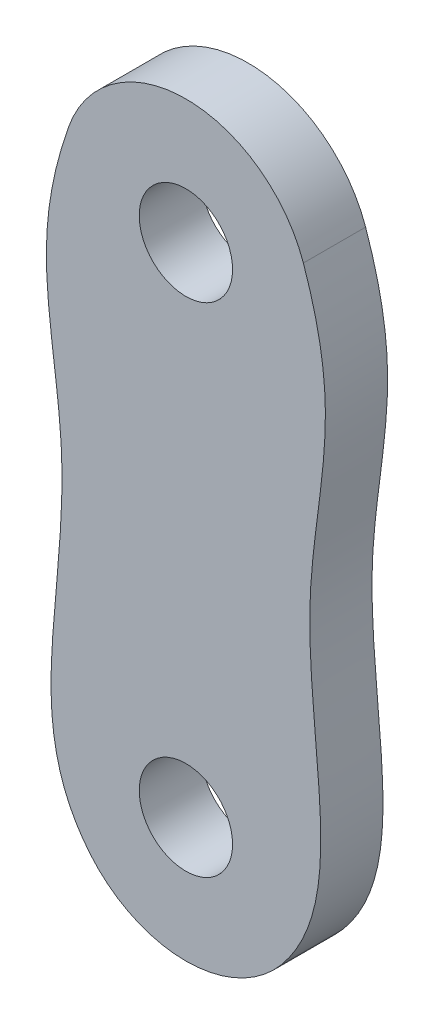
from build123d import *

# Parameters (mm, degrees)
SKETCH1_R           = 2.38125
BOSS_EXTRUDE1_DEPTH = 3.175


with BuildPart() as part:
    # Sketch1 → Boss-Extrude1 (new body)
    with BuildSketch(Plane.XY):
        with BuildLine():
            ThreePointArc((5.995089754, 27.493179122), (0, 31.75), (-5.995089754, 27.493179122))
            add(Edge.make_bspline(
                [(-5.995089754, 27.493179122), (-6.695447175, 25.487280271), (-7.636062062, 20.832001378), (-5.83605341, 13.118062743), (-6.979750328, 4.623489499), (-7.03277938, -1.495925245), (-4.865611487, -4.080235883)],
                knots=[0, 0, 0, 0, 0.186998848, 0.456275956, 0.716521227, 1, 1, 1, 1], degree=3))
            ThreePointArc((-4.865611487, -4.080235883), (0, -6.35), (4.865611487, -4.080235883))
            add(Edge.make_bspline(
                [(5.995089754, 27.493179122), (6.695447175, 25.487280271), (7.636062062, 20.832001378), (5.83605341, 13.118062743), (6.979750328, 4.623489499), (7.03277938, -1.495925245), (4.865611487, -4.080235883)],
                knots=[0, 0, 0, 0, 0.186998848, 0.456275956, 0.716521227, 1, 1, 1, 1], degree=3))
        make_face()
        with Locations((0, 25.4)):
            Circle(SKETCH1_R, mode=Mode.SUBTRACT)
        Circle(SKETCH1_R, mode=Mode.SUBTRACT)
    extrude(amount=BOSS_EXTRUDE1_DEPTH)


solid = part.part
